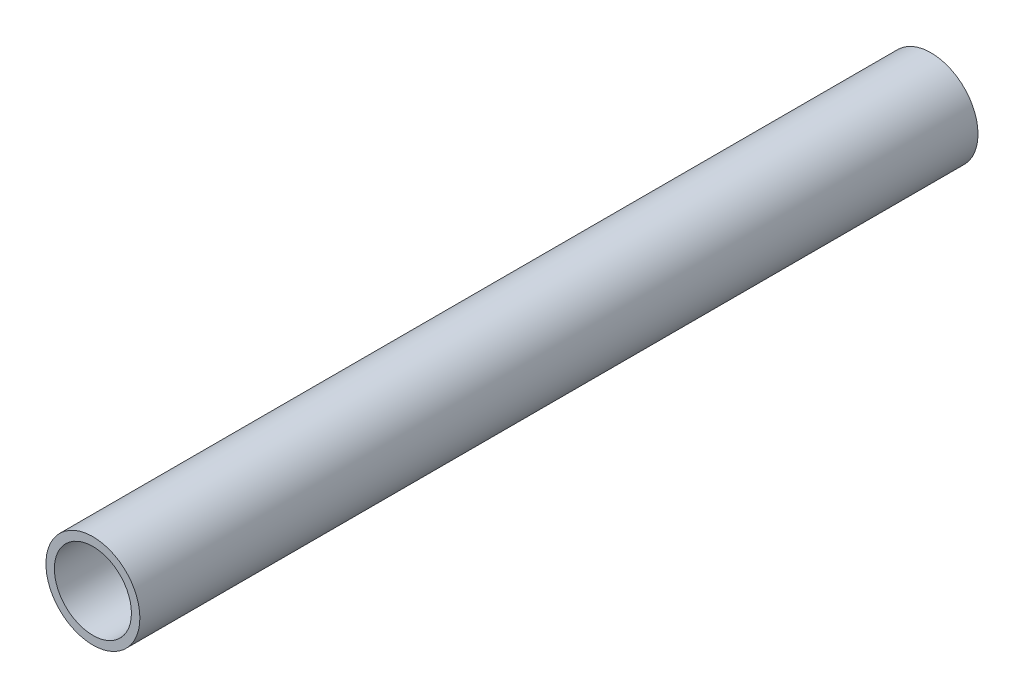
from build123d import *

# Parameters (mm, degrees)
ESQUISSE1_R        = 5
ESQUISSE1_R_2      = 4.1
BOSS_EXTRU_1_DEPTH = 44.6


with BuildPart() as part:
    # Esquisse1 → Boss.-Extru.1 (new, symmetric)
    with BuildSketch(Plane.XY):
        Circle(ESQUISSE1_R)
        Circle(ESQUISSE1_R_2, mode=Mode.SUBTRACT)
    extrude(amount=BOSS_EXTRU_1_DEPTH, both=True)


solid = part.part
